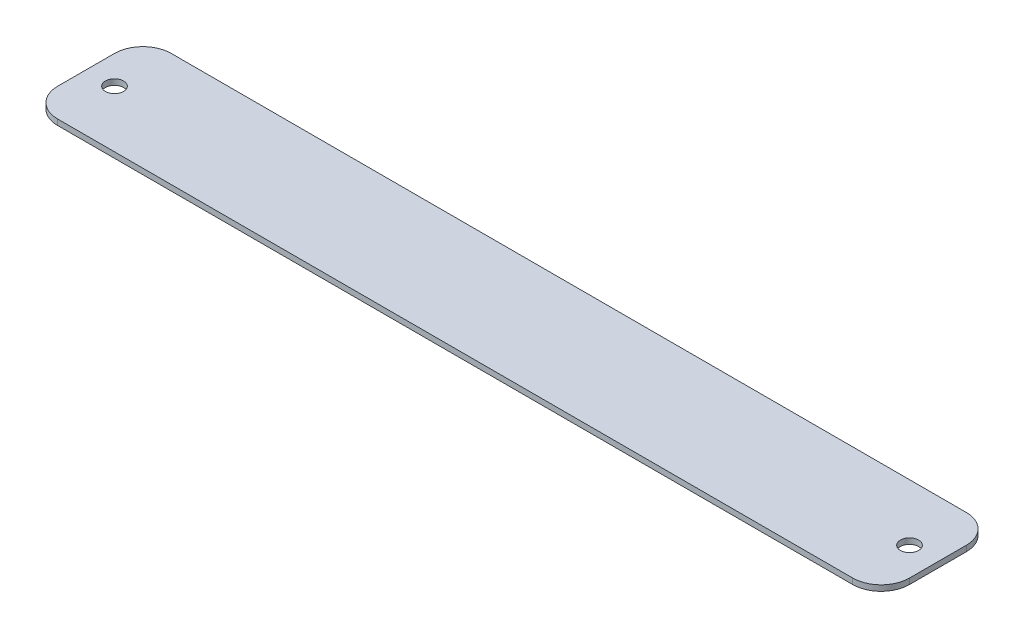
from build123d import *

# Parameters (mm, degrees)
SKETCH_1_W      = 150
SKETCH_1_H      = 20
SKETCH_1_R      = 1.6
EXTRUDE_1_DEPTH = 1
FILLET_1_R      = 5


with BuildPart() as part:
    # 草图1 → 凸台-拉伸1 (new body)
    with BuildSketch(Plane(origin=(0, 0, 0), x_dir=(1, 0, 0), z_dir=(0, 1, 0))):
        Rectangle(SKETCH_1_W, SKETCH_1_H)
        with Locations(Location((-70, 0, 0), (0, 0, 270))):
            Circle(SKETCH_1_R, mode=Mode.SUBTRACT)
        with Locations(Location((70, 0, 0), (0, 0, 270))):
            Circle(SKETCH_1_R, mode=Mode.SUBTRACT)
    extrude(amount=EXTRUDE_1_DEPTH)

    # 圆角1
    fillet_1_edges = [part.edges().sort_by_distance(p)[0] for p in [
        (75, 0.5, 10),
        (-75, 0.5, 10),
        (-75, 0.5, -10),
        (75, 0.5, -10),
    ]]
    fillet(fillet_1_edges, radius=FILLET_1_R)


solid = part.part
